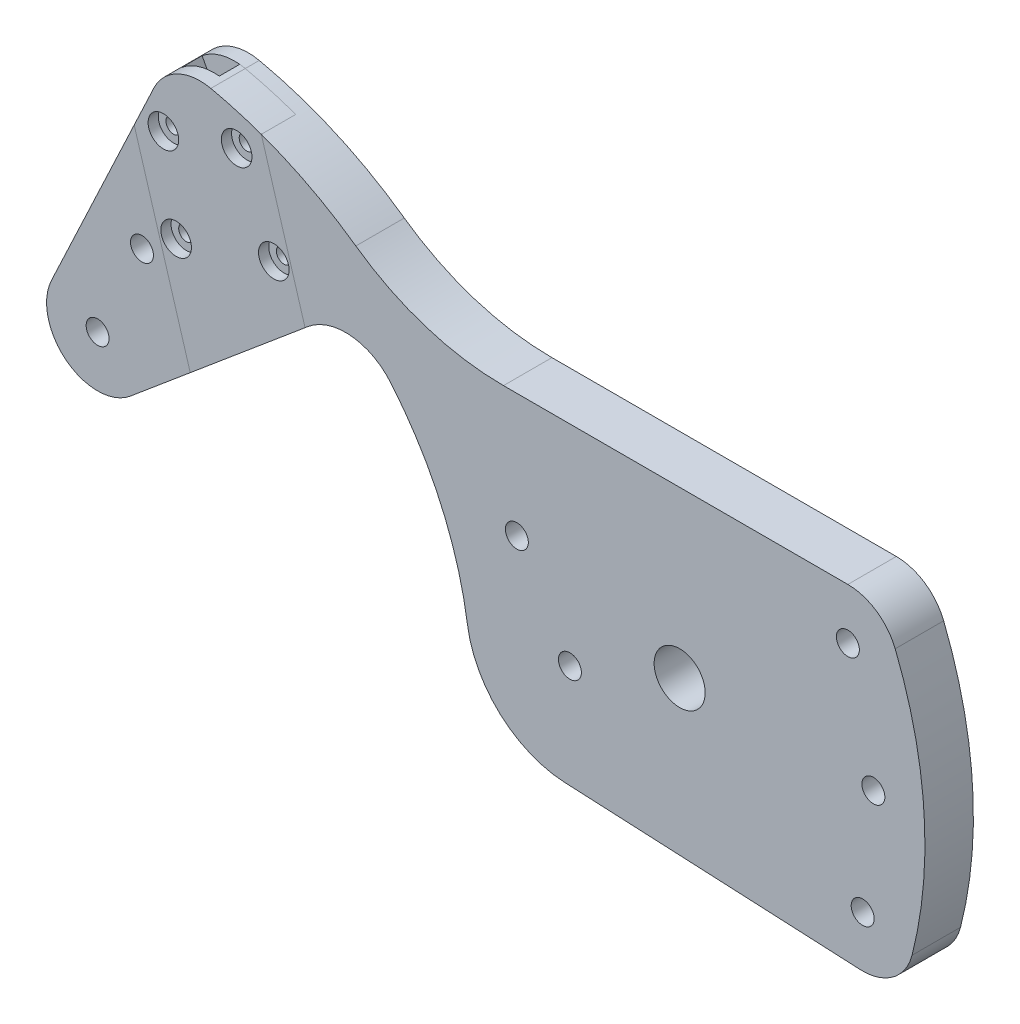
from build123d import *

# Parameters (mm, degrees)
SKETCH1_R              = 5
SKETCH1_R_2            = 2.25
BOSS_EXTRUDE1_DEPTH    = 4.75
CUT_EXTRUDE1_DEPTH     = 2
SKETCH4_R              = 1.5
CUT_EXTRUDE2_DEPTH     = 136.849086626
SKETCH5_R              = 3
CUT_EXTRUDE3_DEPTH     = 2
SPLIT3_SURFACE_1_BACK  = 193.818
SPLIT3_SURFACE_1_DEPTH = 387.636
SPLIT3_SURFACE_2_BACK  = 193.818
SPLIT3_SURFACE_2_DEPTH = 387.636


with BuildPart() as part:
    # Sketch1 → Boss-Extrude1 (new, symmetric)
    with BuildSketch(Plane.XY):
        with BuildLine():
            Line((-22.500230832, -28.983987123), (35.398437983, -31.788291003))
            ThreePointArc((35.398437983, -31.788291003), (41.825152283, -29.842482755), (45.572267137, -24.270413418))
            ThreePointArc((45.572267137, -24.270413418), (47.922199842, 1.185089324), (42.266415188, 26.115330067))
            ThreePointArc((42.266415188, 26.115330067), (38.587871094, 30.681102), (32.982217728, 32.4))
            Line((32.982217728, 32.4), (-34.53815208, 32.4))
            ThreePointArc((-34.53815208, 32.4), (-49.730929753, 34.764094355), (-63.487021029, 41.632819737))
            ThreePointArc((-63.487021029, 41.632819737), (-77.067258547, 49.344582351), (-91.918742124, 54.174444589))
            ThreePointArc((-91.918742124, 54.174444589), (-98.466295495, 53.366674665), (-103.085929893, 48.656905518))
            Line((-103.085929893, 48.656905518), (-123.167077545, 5.955614534))
            ThreePointArc((-123.167077545, 5.955614534), (-120.218280198, -6.2236308), (-107.689906175, -5.960444431))
            Line((-107.689906175, -5.960444431), (-72.864818345, 23.261273923))
            ThreePointArc((-72.864818345, 23.261273923), (-64.470178387, 25.908093735), (-56.662687309, 21.843771132))
            ThreePointArc((-56.662687309, 21.843771132), (-46.809939593, 6.135423294), (-41.608278072, -11.662653759))
            ThreePointArc((-41.608278072, -11.662653759), (-35.156858245, -23.745961099), (-22.500230832, -28.983987123))
        make_face()
        Circle(SKETCH1_R, mode=Mode.SUBTRACT)
        with Locations((35.882217728, -21.8)):
            Circle(SKETCH1_R_2, mode=Mode.SUBTRACT)
        with Locations((-21.517782272, -8.7)):
            Circle(SKETCH1_R_2, mode=Mode.SUBTRACT)
        with Locations((37.982217728, -0.1)):
            Circle(SKETCH1_R_2, mode=Mode.SUBTRACT)
        with Locations((32.982217728, 22.4)):
            Circle(SKETCH1_R_2, mode=Mode.SUBTRACT)
        with Locations((-31.917782272, 8.2)):
            Circle(SKETCH1_R_2, mode=Mode.SUBTRACT)
        with Locations((-105.417782272, 20.2)):
            Circle(SKETCH1_R_2, mode=Mode.SUBTRACT)
        with Locations((-114.117782272, 1.7)):
            Circle(SKETCH1_R_2, mode=Mode.SUBTRACT)
    extrude(amount=BOSS_EXTRUDE1_DEPTH, both=True)

    # Sketch2 → Cut-Extrude1 (cut, symmetric)
    with BuildSketch(Plane.XY):
        with BuildLine():
            Line((-78.227129447, 18.761760655), (-92.084556702, 44.987885053))
            Line((-92.084556702, 44.987885053), (-93.002217677, 54.347646176))
            ThreePointArc((-93.002217677, 54.347646176), (-96.914482214, 53.978242129), (-100.382341665, 52.129939126))
            Line((-100.382341665, 52.129939126), (-95.988712538, 43.814696915))
            Line((-95.988712538, 43.814696915), (-92.369017313, 6.895307763))
            Line((-92.369017313, 6.895307763), (-78.227129447, 18.761760655))
        make_face()
    extrude(amount=CUT_EXTRUDE1_DEPTH, both=True, mode=Mode.SUBTRACT)

    # Sketch4 → Cut-Extrude2 (cut, through all)
    with BuildSketch(Plane.XY.offset(4.75)):
        with Locations((-98.721244854, 25.242626445)):
            Circle(SKETCH4_R)
        with Locations((-101.219347979, 42.242905289)):
            Circle(SKETCH4_R)
        with Locations((-86.853921262, 46.55967668)):
            Circle(SKETCH4_R)
        with Locations((-79.567342565, 30.998321633)):
            Circle(SKETCH4_R)
    extrude(amount=-CUT_EXTRUDE2_DEPTH, mode=Mode.SUBTRACT)

    # Sketch5 → Cut-Extrude3 (cut)
    with BuildSketch(Plane.XY.offset(4.75)):
        with Locations((-101.219347979, 42.242905289)):
            Circle(SKETCH5_R)
        with Locations((-86.853921262, 46.55967668)):
            Circle(SKETCH5_R)
        with Locations((-79.567342565, 30.998321633)):
            Circle(SKETCH5_R)
        with Locations((-98.721244854, 25.242626445)):
            Circle(SKETCH5_R)
    extrude(amount=-CUT_EXTRUDE3_DEPTH, mode=Mode.SUBTRACT)


with BuildPart() as body_2:
    # Split3: the piece behind the surface
    add(part.part)
    # Split3 surface: a surface, the sketch's curves swept straight by 387.636 mm
    with BuildLine(Plane(origin=(-20.02556284, 66.641415389, 0), x_dir=(0.9576951144500195, 0.2877847594271872, 0), z_dir=(-0.2877847594271872, 0.9576951144500195, 0)).offset(-SPLIT3_SURFACE_1_BACK), mode=Mode.PRIVATE) as split3_surface_1_path:
        Line((-63.780410711, -4.75), (-63.780410711, 2))
        Line((-63.780410711, 2), (-90.780410711, 2))
        Line((-90.780410711, 2), (-90.780410711, -4.75))
    split3_surface_1 = Shell.extrude(split3_surface_1_path.wire(), (-0.287784759 * SPLIT3_SURFACE_1_DEPTH, 0.957695114 * SPLIT3_SURFACE_1_DEPTH, 0 * SPLIT3_SURFACE_1_DEPTH))
    split(bisect_by=split3_surface_1, keep=Keep.BOTTOM)


with BuildPart() as part_1:
    add(part.part)

    # Split3: split by a surface, the side it looks to stays
    # Split3 surface: a surface, the sketch's curves swept straight by 387.636 mm
    with BuildLine(Plane(origin=(-20.02556284, 66.641415389, 0), x_dir=(0.9576951144500195, 0.2877847594271872, 0), z_dir=(-0.2877847594271872, 0.9576951144500195, 0)).offset(-SPLIT3_SURFACE_2_BACK), mode=Mode.PRIVATE) as split3_surface_2_path:
        Line((-63.780410711, -4.75), (-63.780410711, 2))
        Line((-63.780410711, 2), (-90.780410711, 2))
        Line((-90.780410711, 2), (-90.780410711, -4.75))
    split3_surface_2 = Shell.extrude(split3_surface_2_path.wire(), (-0.287784759 * SPLIT3_SURFACE_2_DEPTH, 0.957695114 * SPLIT3_SURFACE_2_DEPTH, 0 * SPLIT3_SURFACE_2_DEPTH))
    split(bisect_by=split3_surface_2, keep=Keep.TOP)


solid = Compound([body_2.part, part_1.part])
